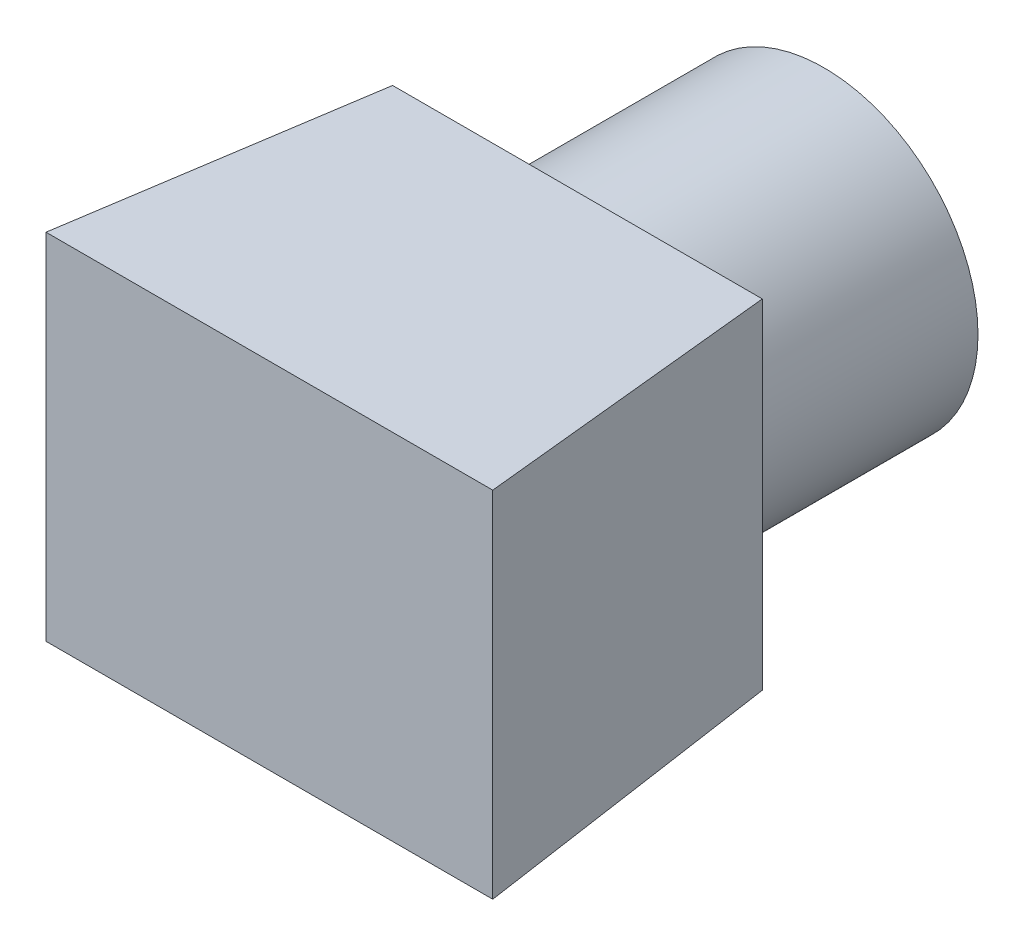
from build123d import *

# Parameters (mm, degrees)
SKETCH1_R           = 5
BOSS_EXTRUDE1_DEPTH = 8
SKETCH2_W           = 12
SKETCH2_H           = 11
BOSS_EXTRUDE2_DEPTH = 10


with BuildPart() as part:
    # Sketch1 → Boss-Extrude1 (new body)
    with BuildSketch(Plane.XY):
        Circle(SKETCH1_R)
    extrude(amount=BOSS_EXTRUDE1_DEPTH)

    # Sketch2 → Boss-Extrude2 (add)
    with BuildSketch(Plane.XY.offset(8)):
        Rectangle(SKETCH2_W, SKETCH2_H)
    extrude(amount=BOSS_EXTRUDE2_DEPTH)

    # Sketch3 → Loft1 section 0
    with BuildSketch(Plane(origin=(0, 0, 8), x_dir=(-1, 0, 0), z_dir=(0, 0, -1))):
        with BuildLine():
            Line((6, -5.5), (6, 5.5))
            Line((6, 5.5), (-6, 5.5))
            Line((-6, 5.5), (-6, -5.5))
            Line((-6, -5.5), (6, -5.5))
        make_face()
    # Sketch4 → Loft1 section 1
    with BuildSketch(Plane.XY.offset(18)):
        with BuildLine():
            Line((7.25, -5.75), (-7.25, -5.75))
            Line((-7.25, -5.75), (-7.25, 5.75))
            Line((-7.25, 5.75), (7.25, 5.75))
            Line((7.25, 5.75), (7.25, -5.75))
        make_face()
    loft()


solid = part.part
